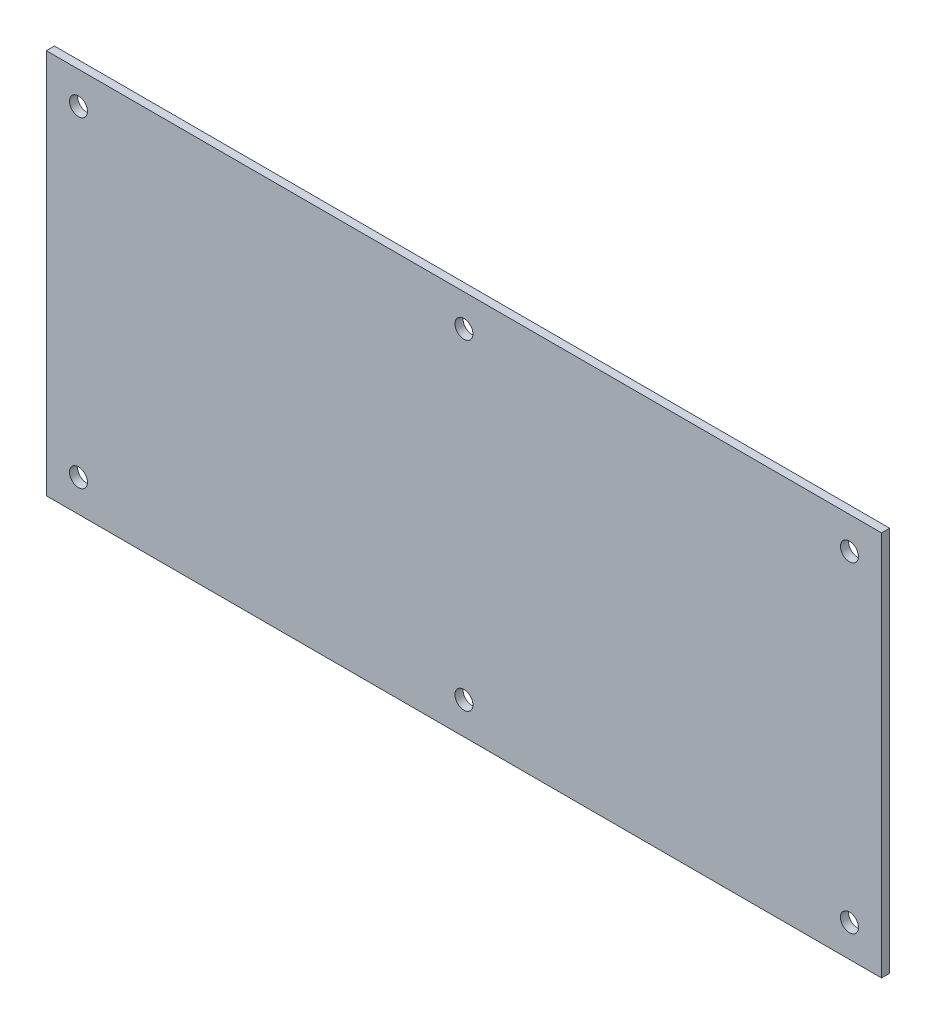
from build123d import *

# Parameters (mm, degrees)
SKETCH1_W          = 165.1
SKETCH1_H          = 76.2
EXTRUDE1_DEPTH     = 1.6002
SKETCH2_R          = 1.778
CUT_EXTRUDE1_DEPTH = 2.54


with BuildPart() as part:
    # Sketch1 → Extrude1 (new body)
    with BuildSketch(Plane.XY):
        with Locations((82.55, 38.1)):
            Rectangle(SKETCH1_W, SKETCH1_H)
    extrude(amount=-EXTRUDE1_DEPTH)

    # Sketch2 → Cut-Extrude1 (cut)
    with BuildSketch(Plane.XY):
        with Locations((6.35, 69.85)):
            Circle(SKETCH2_R)
        with Locations((158.75, 69.85)):
            Circle(SKETCH2_R)
        with Locations((158.75, 6.35)):
            Circle(SKETCH2_R)
        with Locations((6.35, 6.35)):
            Circle(SKETCH2_R)
        with Locations((82.55, 6.35)):
            Circle(SKETCH2_R)
        with Locations((82.55, 69.85)):
            Circle(SKETCH2_R)
    extrude(amount=-CUT_EXTRUDE1_DEPTH, mode=Mode.SUBTRACT)


solid = part.part
